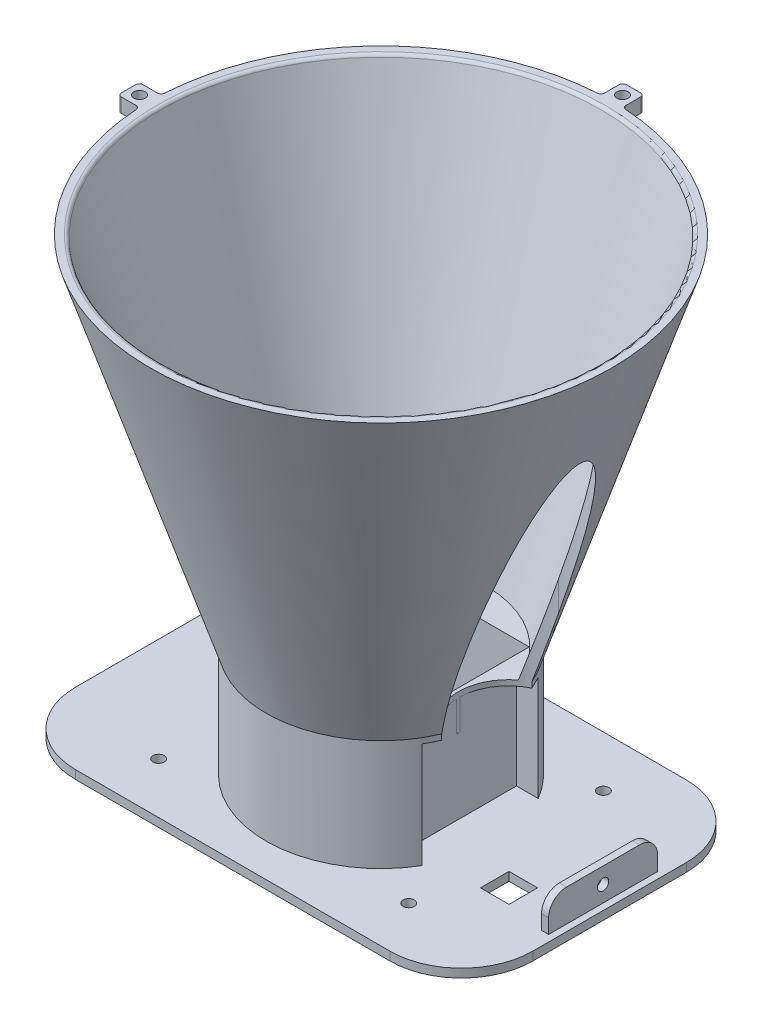
from build123d import *

# Parameters (mm, degrees)
SKETCH2_W             = 128
SKETCH2_H             = 83
BOSS_EXTRUDE1_DEPTH   = 2.4
SKETCH4_R             = 1.575
CUT_EXTRUDE1_DEPTH    = 153.573785429
SKETCH5_R             = 1.85
CUT_EXTRUDE2_DEPTH    = 153.573785429
SKETCH6_R             = 32.173358544
BOSS_EXTRUDE2_DEPTH   = 31
SKETCH7_W             = 41.5
SKETCH7_H             = 41.5
CUT_EXTRUDE5_DEPTH    = 156.672733643
SKETCH9_W             = 6
SKETCH9_H             = 6
BOSS_EXTRUDE3_DEPTH   = 4
BOSS_EXTRUDE3_2_DEPTH = 4
BOSS_EXTRUDE4_REACH   = 219.032
SKETCH10_W            = 6
SKETCH10_H            = 4
BOSS_EXTRUDE5_REACH   = 228.002
SKETCH11_W            = 6
SKETCH11_H            = 4
SKETCH12_R            = 1.575
CUT_EXTRUDE6_DEPTH    = 217.636533196
SKETCH13_W            = 30.5
SKETCH13_H            = 2.4
BOSS_EXTRUDE6_DEPTH   = 4.5
SKETCH14_W            = 8.32
SKETCH14_H            = 30.5
BOSS_EXTRUDE7_DEPTH   = 9
SKETCH15_R            = 1.575
CUT_EXTRUDE7_DEPTH    = 9
SKETCH17_W            = 8
SKETCH17_H            = 8
CUT_EXTRUDE9_DEPTH    = 10
SKETCH18_W            = 6
SKETCH18_H            = 10
CUT_EXTRUDE10_DEPTH   = 10
FILLET3_R             = 20
FILLET4_R             = 1
FILLET6_R             = 5
FILLET7_R             = 1
SKETCH19_W            = 41.5
SKETCH19_H            = 41.5
SKETCH19_R            = 1.575
SKETCH19_W_2          = 6
SKETCH19_H_2          = 10
BOSS_EXTRUDE8_DEPTH   = 8
SKETCH20_W            = 41.5
SKETCH20_H            = 41.5
SKETCH20_R            = 1.575
SKETCH20_W_2          = 6
SKETCH20_H_2          = 10
CUT_EXTRUDE11_DEPTH   = 5.5
SKETCH22_W            = 29.5
SKETCH22_H            = 32.5
CUT_EXTRUDE12_DEPTH   = 10.5
CUT_EXTRUDE13_DEPTH   = 207.720230403
CUT_EXTRUDE14_DEPTH   = 110


with BuildPart() as part:
    # Sketch2 → Boss-Extrude1 (new body)
    with BuildSketch(Plane(origin=(0, 0, 0), x_dir=(1, 0, 0), z_dir=(0, 1, 0))):
        with Locations((64, 41.5)):
            Rectangle(SKETCH2_W, SKETCH2_H)
    extrude(amount=BOSS_EXTRUDE1_DEPTH)

    # Sketch4 → Cut-Extrude1 (cut, through all)
    with BuildSketch(Plane(origin=(0, 2.4, 0), x_dir=(1, 0, 0), z_dir=(0, 1, 0))):
        with Locations(Location((29, 68.75, 0), (0, 0, 270))):
            Circle(SKETCH4_R)
        with Locations(Location((99, 68.75, 0), (0, 0, 270))):
            Circle(SKETCH4_R)
        with Locations(Location((29, 14.25, 0), (0, 0, 270))):
            Circle(SKETCH4_R)
        with Locations(Location((99, 14.25, 0), (0, 0, 270))):
            Circle(SKETCH4_R)
    extrude(amount=-CUT_EXTRUDE1_DEPTH, mode=Mode.SUBTRACT)

    # Sketch5 → Cut-Extrude2 (cut, through all)
    with BuildSketch(Plane(origin=(0, 2.4, 0), x_dir=(1, 0, 0), z_dir=(0, 1, 0))):
        with Locations(Location((47.5, 58, 0), (0, 0, 270))):
            Circle(SKETCH5_R)
        with Locations(Location((80.5, 58, 0), (0, 0, 270))):
            Circle(SKETCH5_R)
        with Locations(Location((47.5, 25, 0), (0, 0, 270))):
            Circle(SKETCH5_R)
        with Locations(Location((80.5, 25, 0), (0, 0, 270))):
            Circle(SKETCH5_R)
    extrude(amount=-CUT_EXTRUDE2_DEPTH, mode=Mode.SUBTRACT)

    # Sketch6 → Boss-Extrude2 (add)
    with BuildSketch(Plane(origin=(0, 2.4, 0), x_dir=(1, 0, 0), z_dir=(0, 1, 0))):
        with Locations(Location((64, 41.5, 0), (0, 0, 270))):
            Circle(SKETCH6_R)
    extrude(amount=BOSS_EXTRUDE2_DEPTH)

    # Sketch7 → Cut-Extrude5 (cut, through all)
    with BuildSketch(Plane(origin=(0, 2.4, 0), x_dir=(1, 0, 0), z_dir=(0, 1, 0))):
        with Locations((64, 41.5)):
            Rectangle(SKETCH7_W, SKETCH7_H)
    extrude(amount=CUT_EXTRUDE5_DEPTH, mode=Mode.SUBTRACT)

    # Sketch8 → Revolve1 (revolve)
    with BuildSketch(Plane.XY.offset(-41.5), mode=Mode.PRIVATE) as revolve1_sk:
        Polygon((96.173358544, 33.4), (128.665328167, 133.4), (125.965328167, 133.4), (93.473358544, 33.4), align=None)
    revolve(revolve1_sk.sketch.rotate(Axis((64, 33.4, -41.5), (0, 1, 0)), 270), axis=Axis((64, 33.4, -41.5), (0, 1, 0)))

    # Sketch10 → Boss-Extrude4 (add, up to next)
    with BuildSketch(Plane(origin=(-0.665328167, 0, 0), x_dir=(0, 0, -1), z_dir=(1, 0, 0)), mode=Mode.PRIVATE) as boss_extrude4_sk1:
        with Locations((41.5, 131.4)):
            Rectangle(SKETCH10_W, SKETCH10_H)
    boss_extrude4_tool1 = extrude(boss_extrude4_sk1.sketch, amount=BOSS_EXTRUDE4_REACH, mode=Mode.PRIVATE) - part.part


with BuildPart() as body_2:
    # Sketch9 → Boss-Extrude3 (new body)
    with BuildSketch(Plane(origin=(0, 133.4, 0), x_dir=(1, 0, 0), z_dir=(0, 1, 0))):
        with Locations((64, 109.165328167)):
            Rectangle(SKETCH9_W, SKETCH9_H)
    extrude(amount=-BOSS_EXTRUDE3_DEPTH)


with BuildPart() as body_3:
    # Sketch9 → Boss-Extrude3 2 (new body)
    with BuildSketch(Plane(origin=(0, 133.4, 0), x_dir=(1, 0, 0), z_dir=(0, 1, 0))):
        with Locations((-3.665328167, 41.5)):
            Rectangle(SKETCH9_W, SKETCH9_H)
    extrude(amount=-BOSS_EXTRUDE3_2_DEPTH)


with BuildPart() as part_1:
    add(part.part)

    add(body_3.part)  # Boss-Extrude4 merges body 3
    add(boss_extrude4_tool1.solids().sort_by_distance((-0.665328, 131.4, -41.5))[0])

    # Sketch11 → Boss-Extrude5 (add, up to next)
    with BuildSketch(Plane.XY.offset(-106.165328167), mode=Mode.PRIVATE) as boss_extrude5_sk1:
        with Locations((64, 131.4)):
            Rectangle(SKETCH11_W, SKETCH11_H)
    boss_extrude5_tool1 = extrude(boss_extrude5_sk1.sketch, amount=BOSS_EXTRUDE5_REACH, mode=Mode.PRIVATE) - part_1.part

    add(body_2.part)  # Boss-Extrude5 merges body 2
    add(boss_extrude5_tool1.solids().sort_by_distance((64, 131.4, -106.165328))[0])

    # Sketch12 → Cut-Extrude6 (cut, through all)
    with BuildSketch(Plane(origin=(0, 133.4, 0), x_dir=(1, 0, 0), z_dir=(0, 1, 0))):
        with Locations(Location((64, 109.130514891, 0), (0, 0, 270))):
            Circle(SKETCH12_R)
        with Locations(Location((-3.630514891, 41.5, 0), (0, 0, 270))):
            Circle(SKETCH12_R)
    extrude(amount=-CUT_EXTRUDE6_DEPTH, mode=Mode.SUBTRACT)

    # Sketch13 → Boss-Extrude6 (add)
    with BuildSketch(Plane(origin=(128, 0, 0), x_dir=(0, 0, -1), z_dir=(1, 0, 0))):
        with Locations((41.5, 1.2)):
            Rectangle(SKETCH13_W, SKETCH13_H)
    extrude(amount=BOSS_EXTRUDE6_DEPTH)

    # Sketch14 → Boss-Extrude7 (add)
    with BuildSketch(Plane(origin=(0, 2.4, 0), x_dir=(1, 0, 0), z_dir=(0, 1, 0))):
        with Locations((128.34, 41.5)):
            Rectangle(SKETCH14_W, SKETCH14_H)
    extrude(amount=BOSS_EXTRUDE7_DEPTH)

    # Sketch15 → Cut-Extrude7 (cut)
    with BuildSketch(Plane(origin=(132.5, 0, 0), x_dir=(0, 0, -1), z_dir=(1, 0, 0))):
        with Locations((41.5, 6.9)):
            Circle(SKETCH15_R)
    extrude(amount=-CUT_EXTRUDE7_DEPTH, mode=Mode.SUBTRACT)

    # Sketch17 → Cut-Extrude9 (cut)
    with BuildSketch(Plane.XZ):
        with Locations((109.33, -32)):
            Rectangle(SKETCH17_W, SKETCH17_H)
    extrude(amount=-CUT_EXTRUDE9_DEPTH, mode=Mode.SUBTRACT)

    # Sketch18 → Cut-Extrude10 (cut)
    with BuildSketch(Plane.XZ):
        with Locations((80.5, -32.85)):
            Rectangle(SKETCH18_W, SKETCH18_H)
    extrude(amount=-CUT_EXTRUDE10_DEPTH, mode=Mode.SUBTRACT)

    # Fillet3
    fillet3_edges = [part_1.edges().sort_by_distance(p)[0] for p in [
        (0, 1.2, -83),
        (0, 1.2, 0),
        (128, 1.2, 0),
        (128, 1.2, -83),
    ]]
    fillet(fillet3_edges, radius=FILLET3_R)

    # Fillet4
    fillet4_edges = [part_1.edges().sort_by_distance(p)[0] for p in [
        (61, 131.399997862, -105.445153953),
        (67, 131.399997862, -105.445153953),
        (0.054846047, 131.399997862, -44.5),
        (-6.665328167, 131.4, -44.5),
        (0.054846047, 131.399997862, -38.5),
        (-6.665328167, 131.4, -38.5),
        (67, 131.4, -112.165328167),
        (61, 131.4, -112.165328167),
    ]]
    fillet(fillet4_edges, radius=FILLET4_R)

    # Fillet6
    fillet6_edges = [part_1.edges().sort_by_distance(p)[0] for p in [
        (128.34, 11.4, -56.75),
        (128.34, 11.4, -26.25),
    ]]
    fillet(fillet6_edges, radius=FILLET6_R)

    # Fillet7
    fillet7_edges = [part_1.edges().sort_by_distance(p)[0] for p in [
        (64, 133.4, -103.465328167),
    ]]
    fillet(fillet7_edges, radius=FILLET7_R)

    # Sketch19 → Boss-Extrude8 (add)
    with BuildSketch(Plane(origin=(0, 2.4, 0), x_dir=(1, 0, 0), z_dir=(0, 1, 0))):
        with Locations((64, 41.5)):
            Rectangle(SKETCH19_W, SKETCH19_H)
        with Locations(Location((80.5, 58, 0), (0, 0, 270))):
            Circle(SKETCH19_R, mode=Mode.SUBTRACT)
        with Locations(Location((47.5, 58, 0), (0, 0, 270))):
            Circle(SKETCH19_R, mode=Mode.SUBTRACT)
        with Locations(Location((47.5, 25, 0), (0, 0, 270))):
            Circle(SKETCH19_R, mode=Mode.SUBTRACT)
        with Locations(Location((80.5, 25, 0), (0, 0, 270))):
            Circle(SKETCH19_R, mode=Mode.SUBTRACT)
        with Locations((80.5, 32.85)):
            Rectangle(SKETCH19_W_2, SKETCH19_H_2, mode=Mode.SUBTRACT)
    extrude(amount=BOSS_EXTRUDE8_DEPTH)

    # Sketch20 → Cut-Extrude11 (cut)
    with BuildSketch(Plane.XZ):
        with Locations((64, -41.5)):
            Rectangle(SKETCH20_W, SKETCH20_H)
        with Locations(Location((47.5, -25, 0), (0, 0, 270))):
            Circle(SKETCH20_R, mode=Mode.SUBTRACT)
        with Locations(Location((80.5, -25, 0), (0, 0, 270))):
            Circle(SKETCH20_R, mode=Mode.SUBTRACT)
        with Locations(Location((80.5, -58, 0), (0, 0, 270))):
            Circle(SKETCH20_R, mode=Mode.SUBTRACT)
        with Locations(Location((47.5, -58, 0), (0, 0, 270))):
            Circle(SKETCH20_R, mode=Mode.SUBTRACT)
        with Locations((80.5, -32.85)):
            Rectangle(SKETCH20_W_2, SKETCH20_H_2, mode=Mode.SUBTRACT)
    extrude(amount=-CUT_EXTRUDE11_DEPTH, mode=Mode.SUBTRACT)

    # Sketch22 → Cut-Extrude12 (cut)
    with BuildSketch(Plane(origin=(96.173358544, 0, 0), x_dir=(0, -1, 0), z_dir=(1, 0, 0))):
        with Locations((-17.15, 41.5)):
            Rectangle(SKETCH22_W, SKETCH22_H)
    extrude(amount=-CUT_EXTRUDE12_DEPTH, mode=Mode.SUBTRACT)

    # Sketch24 → Cut-Extrude13 (cut, through all)
    with BuildSketch(Plane.XY.offset(-26.25)):
        Polygon((128, 2.4), (126.18, 2.4), (126.18, 12.967331146), (132.5, 12.967331146), (132.5, 2.4), (132.5, 0), (128, 0), align=None)
    extrude(amount=-CUT_EXTRUDE13_DEPTH, mode=Mode.SUBTRACT)

    # Sketch25 → Cut-Extrude14 (cut)
    with BuildSketch(Plane(origin=(0, 133.4, 0), x_dir=(1, 0, 0), z_dir=(0, 1, 0))):
        with BuildLine():
            ThreePointArc((99.665328167, 55.5), (85.665328167, 41.5), (99.665328167, 27.5))
            add(Edge.make_bspline(
                [(99.665328167, 27.5), (119.665328167, 27.5), (119.665328167, 41.5), (119.665328167, 55.5), (99.665328167, 55.5)],
                knots=[1.570796327, 1.570796327, 1.570796327, 3.141592654, 3.141592654, 4.71238898, 4.71238898, 4.71238898], degree=2, weights=[1, 0.707106781, 1, 0.707106781, 1]))
        make_face()
    extrude(amount=-CUT_EXTRUDE14_DEPTH, mode=Mode.SUBTRACT)


solid = part_1.part
